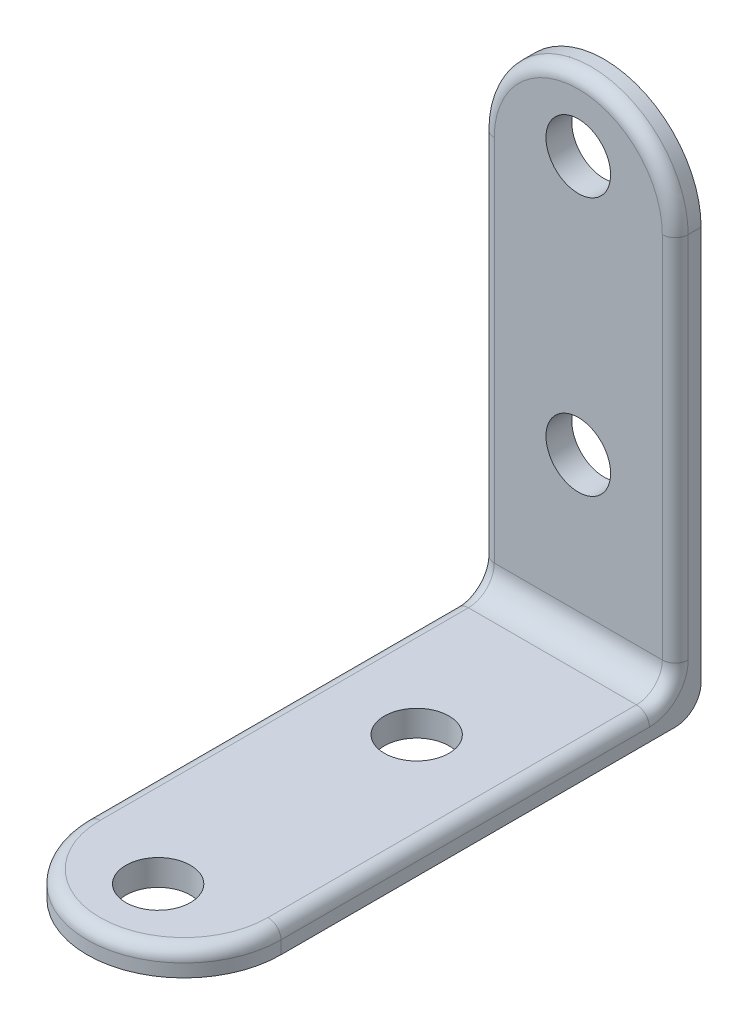
from build123d import *

# Parameters (mm, degrees)
ESQUISSE1_R        = 2.5
BOSS_EXTRU_2_DEPTH = 2
ESQUISSE2_R        = 2.5
ESQUISSE2_W        = 15
ESQUISSE2_H        = 2
BOSS_EXTRU_3_DEPTH = 2
CONG_1_R           = 2
CONG_2_R           = 2
CONG_4_R           = 1


with BuildPart() as part:
    # Esquisse1 → Boss.-Extru.2 (new body)
    with BuildSketch(Plane(origin=(0, 0, 0), x_dir=(1, 0, 0), z_dir=(0, 1, 0))):
        with BuildLine():
            ThreePointArc((-7.5, 0), (0, -7.5), (7.5, 0))
            Line((7.5, 0), (7.5, 32.5))
            Line((7.5, 32.5), (-7.5, 32.5))
            Line((-7.5, 32.5), (-7.5, 0))
        make_face()
        with Locations(Location((0, -2, 0), (0, 0, 270))):
            Circle(ESQUISSE1_R, mode=Mode.SUBTRACT)
        with Locations(Location((0, 18, 0), (0, 0, 270))):
            Circle(ESQUISSE1_R, mode=Mode.SUBTRACT)
    extrude(amount=BOSS_EXTRU_2_DEPTH)

    # Esquisse2 → Boss.-Extru.3 (add)
    # profile 1 of 2: a face of its own
    with BuildSketch(Plane(origin=(0, 0, -32.5), x_dir=(-1, 0, 0), z_dir=(0, 0, -1))):
        with BuildLine():
            Line((-7.5, 32.5), (-7.5, 2))
            Line((-7.5, 2), (7.5, 2))
            Line((7.5, 2), (7.5, 32.5))
            ThreePointArc((7.5, 32.5), (5.303300859, 37.803300859), (0, 40))
            ThreePointArc((0, 40), (-5.303300859, 37.803300859), (-7.5, 32.5))
        make_face()
        with Locations((0, 14.5)):
            Circle(ESQUISSE2_R, mode=Mode.SUBTRACT)
        with Locations((0, 34.5)):
            Circle(ESQUISSE2_R, mode=Mode.SUBTRACT)
    # profile 2 of 2: a face of its own
    with BuildSketch(Plane(origin=(0, 0, -32.5), x_dir=(-1, 0, 0), z_dir=(0, 0, -1))):
        with Locations((0, 1)):
            Rectangle(ESQUISSE2_W, ESQUISSE2_H)
    extrude(amount=-BOSS_EXTRU_3_DEPTH)

    # Congé1
    cong_1_edges = [part.edges().sort_by_distance(p)[0] for p in [
        (0, 0, -32.5),
    ]]
    fillet(cong_1_edges, radius=CONG_1_R)

    # Congé2
    cong_2_edges = [part.edges().sort_by_distance(p)[0] for p in [
        (0, 2, -30.5),
    ]]
    fillet(cong_2_edges, radius=CONG_2_R)

    # Congé4
    cong_4_edges = [part.edges().sort_by_distance(p)[0] for p in [
        (0, 2, 7.5),
        (7.5, 2, -14.25),
        (0, 40, -30.5),
        (-7.5, 2, -14.25),
        (7.5, 18.25, -30.5),
        (-7.5, 18.25, -30.5),
        (-7.5, 2.585786438, -29.914213562),
        (7.5, 2.585786438, -29.914213562),
    ]]
    fillet(cong_4_edges, radius=CONG_4_R)


solid = part.part
